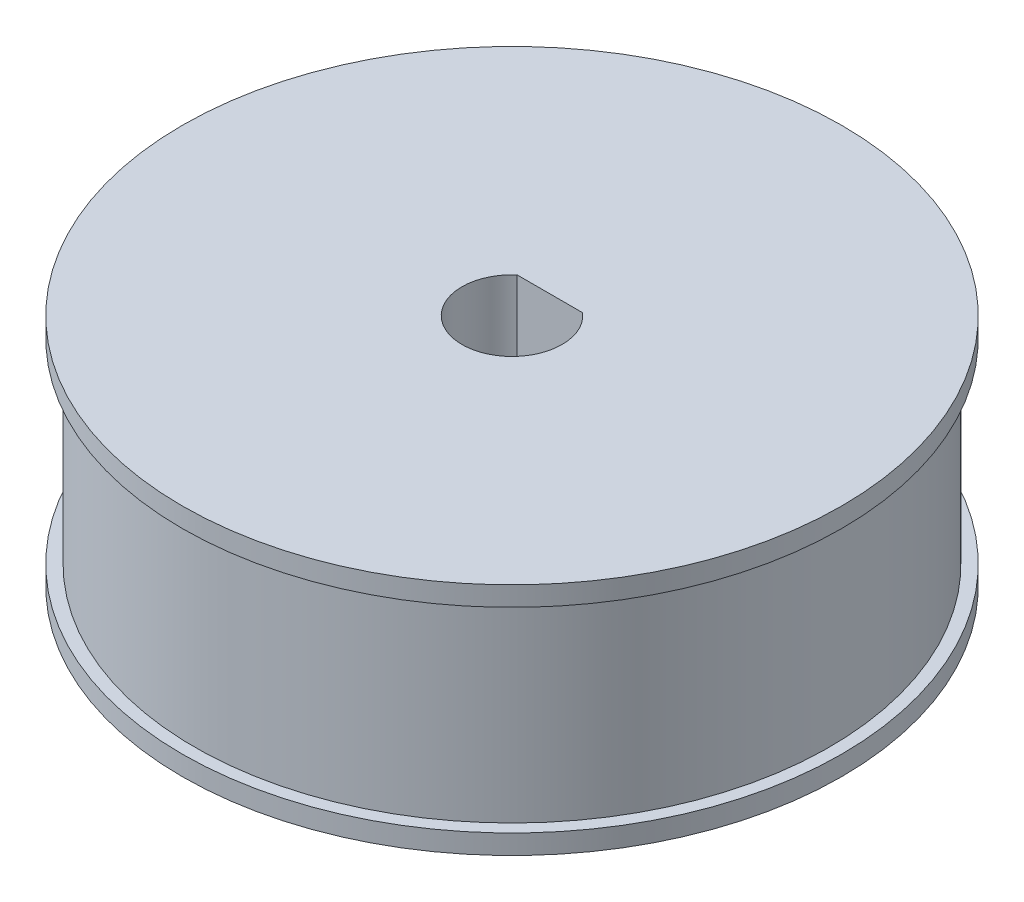
from build123d import *

# Parameters (mm, degrees)
BOSS_EXTRUDE1_START     = -9.6
BOSS_EXTRUDE1_DEPTH     = 9.6
CUT_EXTRUDE1_DEPTH      = 22.369604582
CUT_EXTRUDE1_DEPTH_BACK = 22.369604582


with BuildPart() as part:
    # Sketch1 → Revolve1 (revolve)
    with BuildSketch(Plane.XY, mode=Mode.PRIVATE) as revolve1_sk:
        Polygon((2, 0), (13.5, 0), (13.5, 0.8), (13, 0.8), (13, 8.8), (13.5, 8.8), (13.5, 9.6), (2, 9.6), align=None)
    revolve(revolve1_sk.sketch.rotate(Axis((0, 0, 0), (0, 1, 0)), 90), axis=Axis((0, 0, 0), (0, 1, 0)))

    # Sketch2 → Boss-Extrude1 (add)
    with BuildSketch(Plane(origin=(0, 9.6, 0), x_dir=(1, 0, 0), z_dir=(0, 1, 0)).offset(BOSS_EXTRUDE1_START)):
        with BuildLine():
            Line((-1.322875656, 1.5), (1.322875656, 1.5))
            ThreePointArc((1.322875656, 1.5), (0, 2), (-1.322875656, 1.5))
        make_face()
    extrude(amount=BOSS_EXTRUDE1_DEPTH)

    # Sketch4 → Cut-Extrude1 (cut, two sides: drawn at the far end of the back side and taken through both)
    with BuildSketch(Plane.XZ.offset(-CUT_EXTRUDE1_DEPTH_BACK)):
        with BuildLine():
            Line((-1.341640786, -1.55), (1.341640786, -1.55))
            ThreePointArc((1.341640786, -1.55), (0, 2.05), (-1.341640786, -1.55))
        make_face()
    extrude(amount=CUT_EXTRUDE1_DEPTH + CUT_EXTRUDE1_DEPTH_BACK, mode=Mode.SUBTRACT)


solid = part.part
